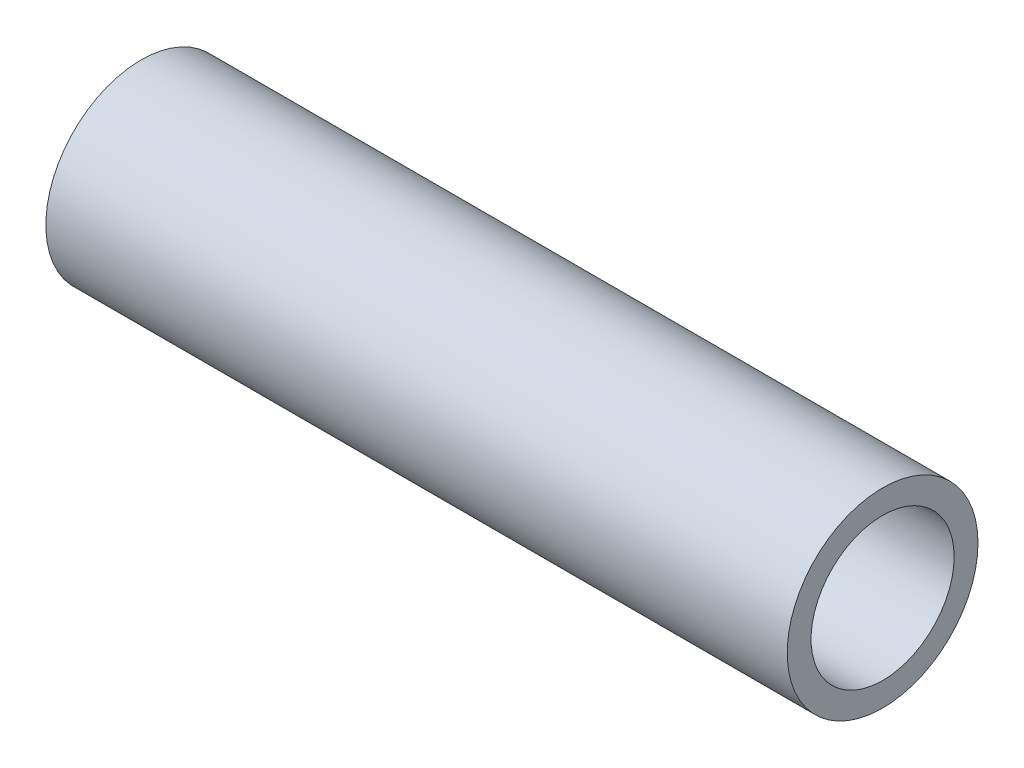
from build123d import *

# Parameters (mm, degrees)
SKETCH1_R           = 7
SKETCH1_R_2         = 5.25
BOSS_EXTRUDE1_DEPTH = 54.4


with BuildPart() as part:
    # Sketch1 → Boss-Extrude1 (new body)
    with BuildSketch(Plane(origin=(0, 0, 0), x_dir=(0, 0, -1), z_dir=(1, 0, 0))):
        Circle(SKETCH1_R)
        Circle(SKETCH1_R_2, mode=Mode.SUBTRACT)
    extrude(amount=BOSS_EXTRUDE1_DEPTH)


solid = part.part
